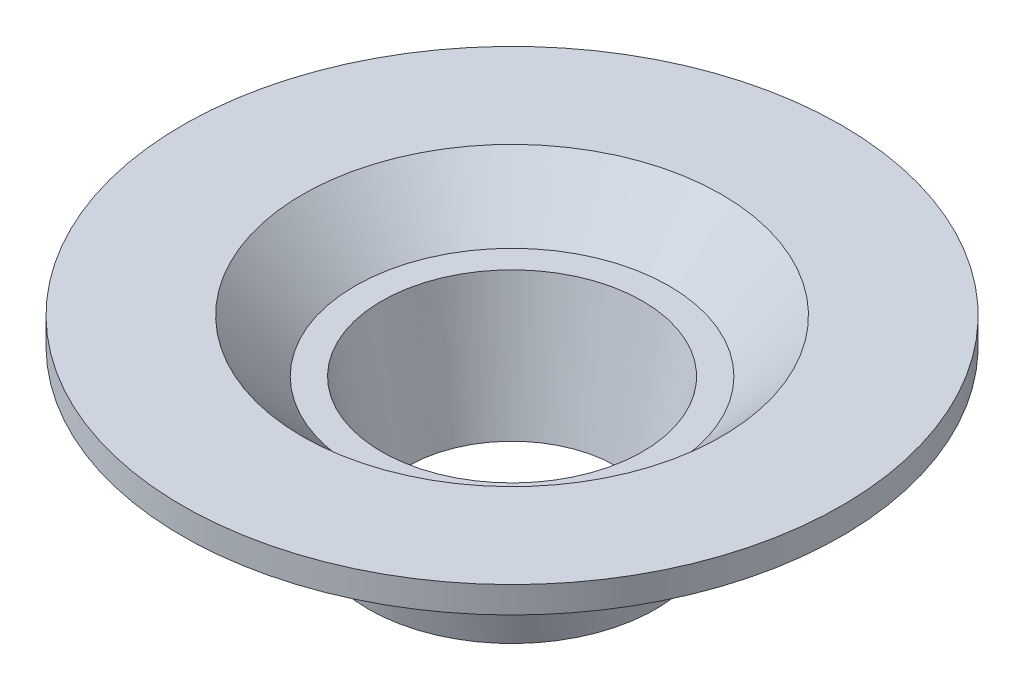
from build123d import *


with BuildPart() as part:
    # Sketch1 → Revolve1 (revolve)
    with BuildSketch(Plane.XY, mode=Mode.PRIVATE) as revolve1_sk:
        Polygon((4.95, 0), (5.95, 0), (7.95, 2), (12.5, 2), (12.5, 1), (10.5, 1), (8.577876198, -0.922123802), (6.25, -0.922123802), (5.45, -4.922123802), (3.95, -4.922123802), align=None)
    revolve(revolve1_sk.sketch.rotate(Axis((0, -4.922123802, 0), (0, 1, 0)), 90), axis=Axis((0, -4.922123802, 0), (0, 1, 0)))


solid = part.part
